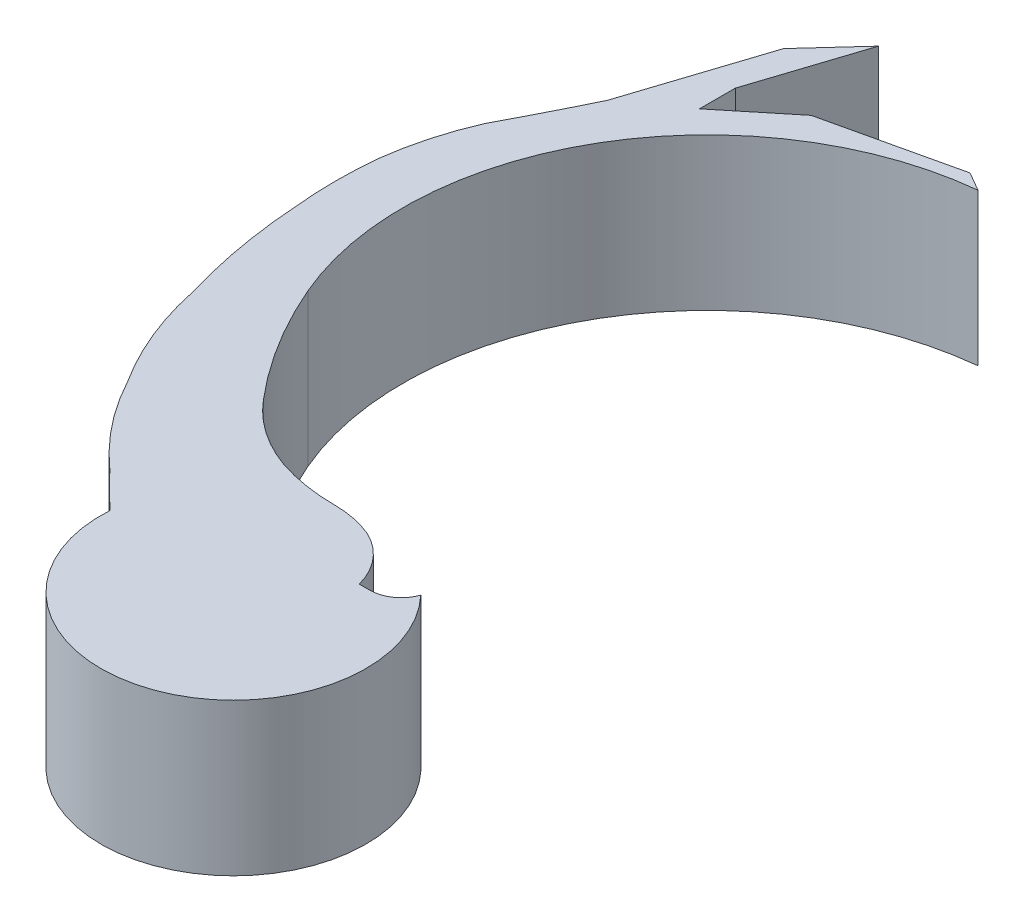
from build123d import *

# Parameters (mm, degrees)
BOSS_EXTRUDE1_DEPTH = 10


with BuildPart() as part:
    # sungu kiri → Boss-Extrude1 (new body)
    with BuildSketch(Plane(origin=(0, 0, 0), x_dir=(1, 0, 0), z_dir=(0, 1, 0))):
        with BuildLine():
            Line((-20.214241335, 18.58200887), (-17.903708636, 25.676772527))
            Line((-17.903708636, 25.676772527), (-20.879327355, 22.419581076))
            Line((-20.879327355, 22.419581076), (-23.726014444, 13.678492013))
            ThreePointArc((-23.726014444, 13.678492013), (-25.061399851, 10.98195956), (-26.444409257, 8.309539974))
            ThreePointArc((-26.444409257, 8.309539974), (-27.383764934, 5.63006722), (-27.936945566, 2.845115782))
            ThreePointArc((-27.936945566, 2.845115782), (-28.068014235, 0.18049064), (-27.936945566, -2.484134502))
            ThreePointArc((-27.936945566, -2.484134502), (-27.425713247, -6.715299694), (-26.444409257, -10.862727794))
            ThreePointArc((-26.444409257, -10.862727794), (-25.296755437, -14.61403578), (-23.488374839, -18.095297119))
            ThreePointArc((-23.488374839, -18.095297119), (-21.509226875, -21.111515913), (-19.028108575, -23.730419207))
            ThreePointArc((-19.028108575, -23.730419207), (-17.889571337, -24.893820319), (-16.718896344, -26.024877014))
            ThreePointArc((-16.718896344, -26.024877014), (-5.074889233, -34.816772241), (-1.682577981, -20.626192702))
            ThreePointArc((-1.682577981, -20.626192702), (-2.440511975, -21.639521262), (-3.645798168, -22.024987085))
            Line((-3.645798168, -22.024987085), (-4.330199558, -22.024987085))
            ThreePointArc((-4.330199558, -22.024987085), (-5.29733591, -20.16091762), (-6.958490383, -18.876132224))
            ThreePointArc((-6.958490383, -18.876132224), (-8.290108773, -18.468617913), (-9.67568618, -18.329152159))
            ThreePointArc((-9.67568618, -18.329152159), (-11.660303974, -18.169286257), (-13.595617391, -17.701496911))
            ThreePointArc((-13.595617391, -17.701496911), (-16.012005666, -16.475638304), (-18.010368345, -14.645827324))
            ThreePointArc((-18.010368345, -14.645827324), (-20.650416196, -11.005311906), (-22.72256926, -7.01414831))
            ThreePointArc((-22.72256926, -7.01414831), (-21.584958488, 10.98418111), (-6.423603233, 20.74980075))
            Line((-6.423603233, 20.74980075), (-7.667855794, 21.470443038))
            Line((-7.667855794, 21.470443038), (-16.17291449, 19.521519125))
            Line((-16.17291449, 19.521519125), (-20.214241335, 16.223172594))
            Line((-20.214241335, 16.223172594), (-20.214241335, 18.58200887))
        make_face()
    extrude(amount=BOSS_EXTRUDE1_DEPTH)


solid = part.part
